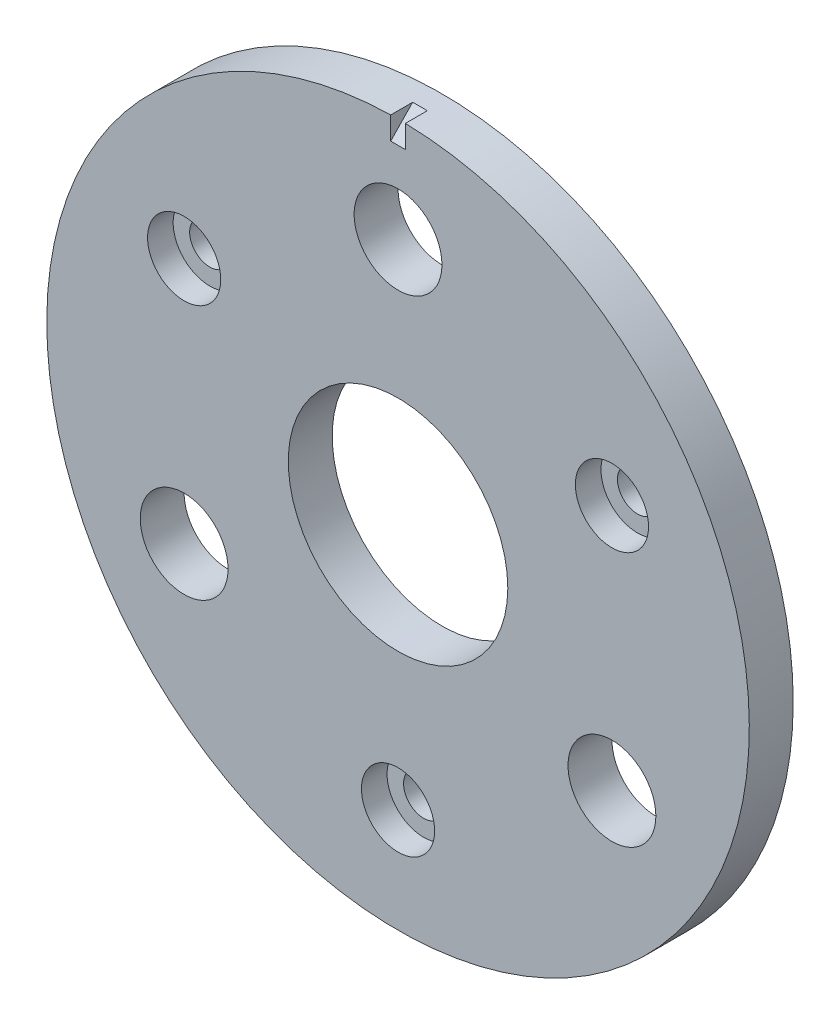
from build123d import *

# Parameters (mm, degrees)
SKETCH1_R                        = 48
SKETCH1_R_2                      = 8
EX_CARRIER_FRONT_PLATE_4MM_DEPTH = 3
SKETCH2_R                        = 6
CUT_PIN_HOLE_12_DEPTH            = 69.14690015
PAT_PIN_HOLES_3X120_COUNT        = 3
CUT_EXTRUDE1_DEPTH               = 1
SKETCH4_R                        = 15
SKETCH4_R_2                      = 2.75
CUT_EXTRUDE2_DEPTH               = 68.948509917
SKETCH5_R                        = 15
SKETCH5_R_2                      = 2.75
CUT_EXTRUDE3_DEPTH               = 68.948509917
SKETCH6_R                        = 2.75
CUT_EXTRUDE4_DEPTH               = 68.948509917
SKETCH7_R                        = 2.75
CUT_EXTRUDE5_DEPTH               = 68.948509917
SKETCH8_R                        = 5
CUT_EXTRUDE7_DEPTH               = 3.5


with BuildPart() as part:
    # Sketch1 → EX_Carrier_Front_Plate_4mm (new, symmetric)
    with BuildSketch(Plane.XY):
        Circle(SKETCH1_R)
        Circle(SKETCH1_R_2, mode=Mode.SUBTRACT)
    extrude(amount=EX_CARRIER_FRONT_PLATE_4MM_DEPTH, both=True)

    # Sketch2 → CUT_Pin_Hole_Ø12 (cut, symmetric)
    with BuildSketch(Plane.XY.offset(3)):
        with Locations((0, 33.75)):
            Circle(SKETCH2_R)
    cut_pin_hole_12 = extrude(amount=CUT_PIN_HOLE_12_DEPTH, both=True, mode=Mode.SUBTRACT)

    # PAT_Pin_Holes_3x120: CUT_Pin_Hole_Ø12 ×3 about axis
    pat_pin_holes_3x120_axis = Axis((0, 0, 3), (0, 0, 1))
    for i in range(1, PAT_PIN_HOLES_3X120_COUNT):
        add(cut_pin_hole_12.rotate(pat_pin_holes_3x120_axis, i * 360 / PAT_PIN_HOLES_3X120_COUNT), mode=Mode.SUBTRACT)

    # Sketch3 → Cut-Extrude1 (cut, symmetric)
    with BuildSketch(Plane(origin=(0, 0, 0), x_dir=(0, 0, -1), z_dir=(1, 0, 0))):
        Polygon((0, 48), (-3, 44.889253006), (-3, 48), align=None)
    extrude(amount=CUT_EXTRUDE1_DEPTH, both=True, mode=Mode.SUBTRACT)

    # Sketch4 → Cut-Extrude2 (cut, through all)
    with BuildSketch(Plane.XY):
        Circle(SKETCH4_R)
        with Locations((0, -33.75)):
            Circle(SKETCH4_R_2)
    extrude(amount=CUT_EXTRUDE2_DEPTH, mode=Mode.SUBTRACT)

    # Sketch5 → Cut-Extrude3 (cut, through all)
    with BuildSketch(Plane.XY):
        Circle(SKETCH5_R)
        with Locations((0, -33.75)):
            Circle(SKETCH5_R_2)
    extrude(amount=-CUT_EXTRUDE3_DEPTH, mode=Mode.SUBTRACT)

    # Sketch6 → Cut-Extrude4 (cut, through all)
    with BuildSketch(Plane.XY):
        with Locations((29.228, 16.875)):
            Circle(SKETCH6_R)
        with Locations((-29.228, 16.875)):
            Circle(SKETCH6_R)
    extrude(amount=CUT_EXTRUDE4_DEPTH, mode=Mode.SUBTRACT)

    # Sketch7 → Cut-Extrude5 (cut, through all)
    with BuildSketch(Plane.XY):
        with Locations((29.228, 16.875)):
            Circle(SKETCH7_R)
        with Locations((-29.228, 16.875)):
            Circle(SKETCH7_R)
    extrude(amount=-CUT_EXTRUDE5_DEPTH, mode=Mode.SUBTRACT)

    # Sketch8 → Cut-Extrude7 (cut)
    with BuildSketch(Plane.XY.offset(3)):
        with Locations((0, -33.75)):
            Circle(SKETCH8_R)
        with Locations((29.228, 16.875)):
            Circle(SKETCH8_R)
        with Locations((-29.228, 16.875)):
            Circle(SKETCH8_R)
    extrude(amount=-CUT_EXTRUDE7_DEPTH, mode=Mode.SUBTRACT)


solid = part.part
